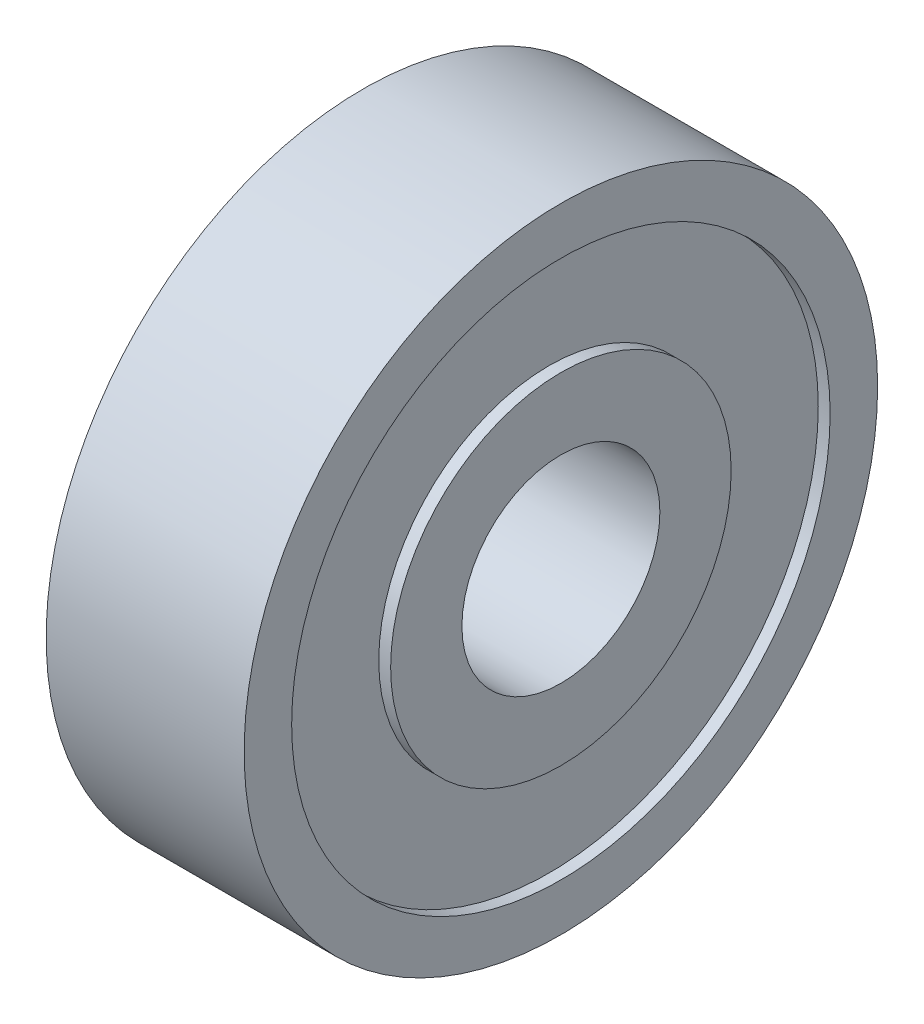
from build123d import *


with BuildPart() as part:
    # Sketch1 → Revolve1 (revolve)
    with BuildSketch(Plane.XY, mode=Mode.PRIVATE) as revolve1_sk:
        Polygon((-2.5, 4.3), (-2.5, 2.5), (2.5, 2.5), (2.5, 4.3), (2.2, 4.3), (2.2, 6.8), (2.5, 6.8), (2.5, 8), (-2.5, 8), (-2.5, 6.8), (-2.2, 6.8), (-2.2, 4.3), align=None)
    revolve(revolve1_sk.sketch.rotate(Axis((-2.5, 0, 0), (1, 0, 0)), 270), axis=Axis((-2.5, 0, 0), (1, 0, 0)))


solid = part.part
